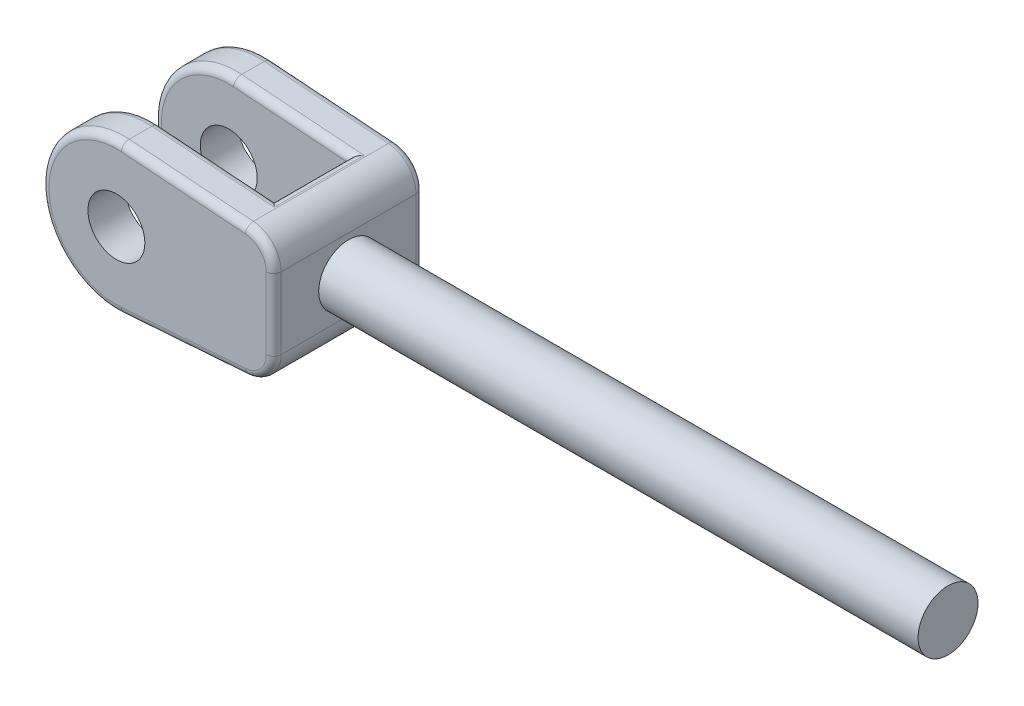
from build123d import *

# Parameters (mm, degrees)
SKETCH1_R               = 1
BOSS_EXTRUDE1_DEPTH     = 20
SKETCH2_R               = 0.95
BOSS_EXTRUDE2_DEPTH     = 2.5
CUT_EXTRUDE1_DEPTH      = 21.310096012
CUT_EXTRUDE1_DEPTH_BACK = 21.310096012
SKETCH3_W               = 6.5
SKETCH3_H               = 2.5
FILLET1_R               = 1
FILLET2_R               = 0.25


with BuildPart() as part:
    # Sketch1 → Boss-Extrude1 (new body)
    with BuildSketch(Plane(origin=(0, 0, 0), x_dir=(0, 0, -1), z_dir=(1, 0, 0))):
        Circle(SKETCH1_R)
    extrude(amount=BOSS_EXTRUDE1_DEPTH)

    # Sketch2 → Boss-Extrude2 (add, symmetric)
    with BuildSketch(Plane.XY):
        with BuildLine():
            Line((0, -2.125), (0, 2.125))
            Line((0, 2.125), (-5.06876613, 2.493422203))
            ThreePointArc((-5.06876613, 2.493422203), (-7.75, 0), (-5.06876613, -2.493422203))
            Line((-5.06876613, -2.493422203), (0, -2.125))
        make_face()
        with Locations((-5.25, 0)):
            Circle(SKETCH2_R, mode=Mode.SUBTRACT)
    extrude(amount=BOSS_EXTRUDE2_DEPTH, both=True)

    # Sketch3 → Cut-Extrude1 (cut, two sides: drawn at the far end of the back side and taken through both)
    with BuildSketch(Plane(origin=(0, 0, 0), x_dir=(1, 0, 0), z_dir=(0, 1, 0)).offset(-CUT_EXTRUDE1_DEPTH_BACK)):
        with Locations((-4.5, 0)):
            Rectangle(SKETCH3_W, SKETCH3_H)
    extrude(amount=CUT_EXTRUDE1_DEPTH + CUT_EXTRUDE1_DEPTH_BACK, mode=Mode.SUBTRACT)

    # Fillet1
    fillet1_edges = [part.edges().sort_by_distance(p)[0] for p in [
        (0, -2.125, 0),
        (0, 2.125, 0),
    ]]
    fillet(fillet1_edges, radius=FILLET1_R)

    # Fillet2
    fillet2_edges = [part.edges().sort_by_distance(p)[0] for p in [
        (-1.25, 2.215855988, 0),
        (-1.25, -2.215855988, 0),
        (-7.75, 0, -1.25),
        (-3.159383065, 2.354639096, -1.25),
        (-3.159383065, -2.354639096, -1.25),
        (-7.75, 0, 1.25),
        (-3.159383065, -2.354639096, 1.25),
        (-3.159383065, 2.354639096, 1.25),
        (-2.998136291, 2.342918908, 2.5),
        (-2.998136291, 2.342918908, -2.5),
        (-2.998136291, -2.342918908, 2.5),
        (0, 0, -2.5),
        (-0.267711277, -1.876041023, -2.5),
        (-0.267711277, 1.876041023, -2.5),
        (0, 0, 2.5),
        (-0.267711277, -1.876041023, 2.5),
        (-0.267711277, 1.876041023, 2.5),
        (-7.75, 0, 2.5),
        (-2.998136291, -2.342918908, -2.5),
        (-7.75, 0, -2.5),
    ]]
    fillet(fillet2_edges, radius=FILLET2_R)


solid = part.part
